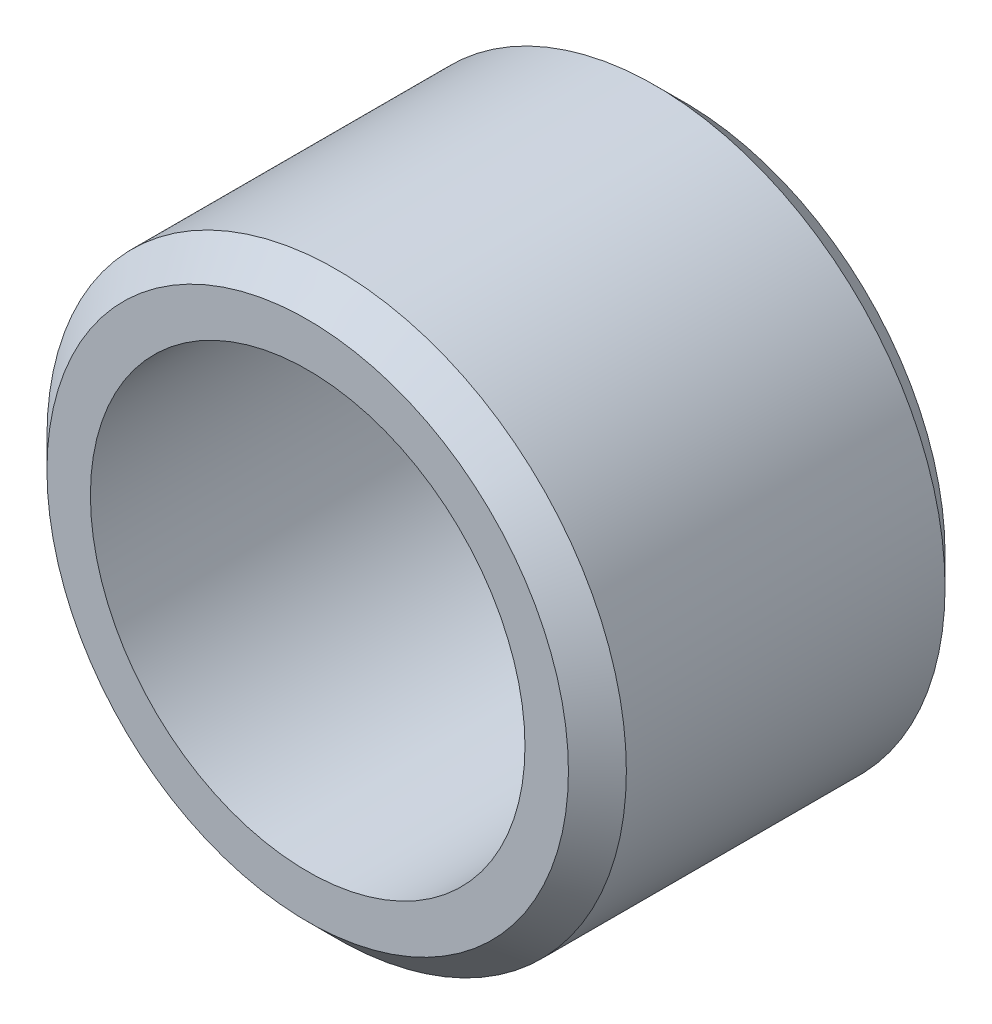
from build123d import *

# Parameters (mm, degrees)
SKETCH1_R           = 10
SKETCH1_R_2         = 7.5
BOSS_EXTRUDE1_DEPTH = 6.5
CHAMFER1_SIZE       = 1


with BuildPart() as part:
    # Sketch1 → Boss-Extrude1 (new, symmetric)
    with BuildSketch(Plane.XY):
        with Locations(Location((0, 0, 0), (0, 0, 180))):
            Circle(SKETCH1_R)
        with Locations(Location((0, 0, 0), (0, 0, 180))):
            Circle(SKETCH1_R_2, mode=Mode.SUBTRACT)
    extrude(amount=BOSS_EXTRUDE1_DEPTH, both=True)

    # Chamfer1
    chamfer1_edges = [part.edges().sort_by_distance(p)[0] for p in [
        (10, 0, -6.5),
        (10, 0, 6.5),
    ]]
    chamfer(chamfer1_edges, length=CHAMFER1_SIZE)


solid = part.part
